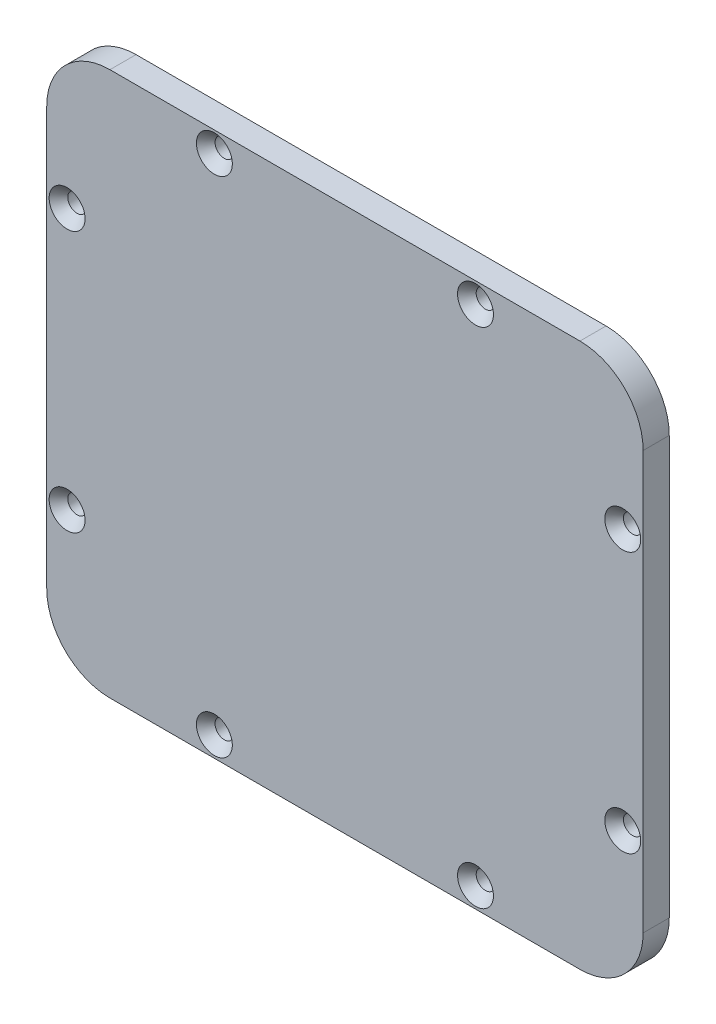
from build123d import *

# Parameters (mm, degrees)
BOSS_EXTRUDE1_DEPTH                            = 3.175
CSK_FOR_2_FLAT_HEAD_MACHINE_SCREW1_D           = 2.2606
CSK_FOR_2_FLAT_HEAD_MACHINE_SCREW1_CSINK_D     = 4.3688
CSK_FOR_2_FLAT_HEAD_MACHINE_SCREW1_CSINK_ANGLE = 82


with BuildPart() as part:
    # Sketch1 → Boss-Extrude1 (new body)
    with BuildSketch(Plane.XY):
        with BuildLine():
            Line((-36.2585, 25.4), (-36.2585, -25.4))
            ThreePointArc((-36.2585, -25.4), (-34.008054953, -30.833054953), (-28.575, -33.0835))
            Line((-28.575, -33.0835), (28.575, -33.0835))
            ThreePointArc((28.575, -33.0835), (34.008054953, -30.833054953), (36.2585, -25.4))
            Line((36.2585, -25.4), (36.2585, 25.4))
            ThreePointArc((36.2585, 25.4), (34.008054953, 30.833054953), (28.575, 33.0835))
            Line((28.575, 33.0835), (-28.575, 33.0835))
            ThreePointArc((-28.575, 33.0835), (-34.008054953, 30.833054953), (-36.2585, 25.4))
        make_face()
    extrude(amount=BOSS_EXTRUDE1_DEPTH)

    # CSK for #2 Flat Head Machine Screw1 (through all)
    with Locations(Plane(origin=(13.435602358, 90.246811513, 3.175), x_dir=(1, 0, 0), z_dir=(0, 0, 1))):
        with Locations((-29.310602358, -59.639811513), (-47.217602358, -74.371811513), (-47.217602358, -106.121811513), (-29.310602358, -120.853811513), (2.439397642, -120.853811513), (20.346397642, -106.121811513), (20.346397642, -74.371811513), (2.439397642, -59.639811513)):
            CounterSinkHole(CSK_FOR_2_FLAT_HEAD_MACHINE_SCREW1_D / 2, CSK_FOR_2_FLAT_HEAD_MACHINE_SCREW1_CSINK_D / 2, counter_sink_angle=CSK_FOR_2_FLAT_HEAD_MACHINE_SCREW1_CSINK_ANGLE)


solid = part.part
